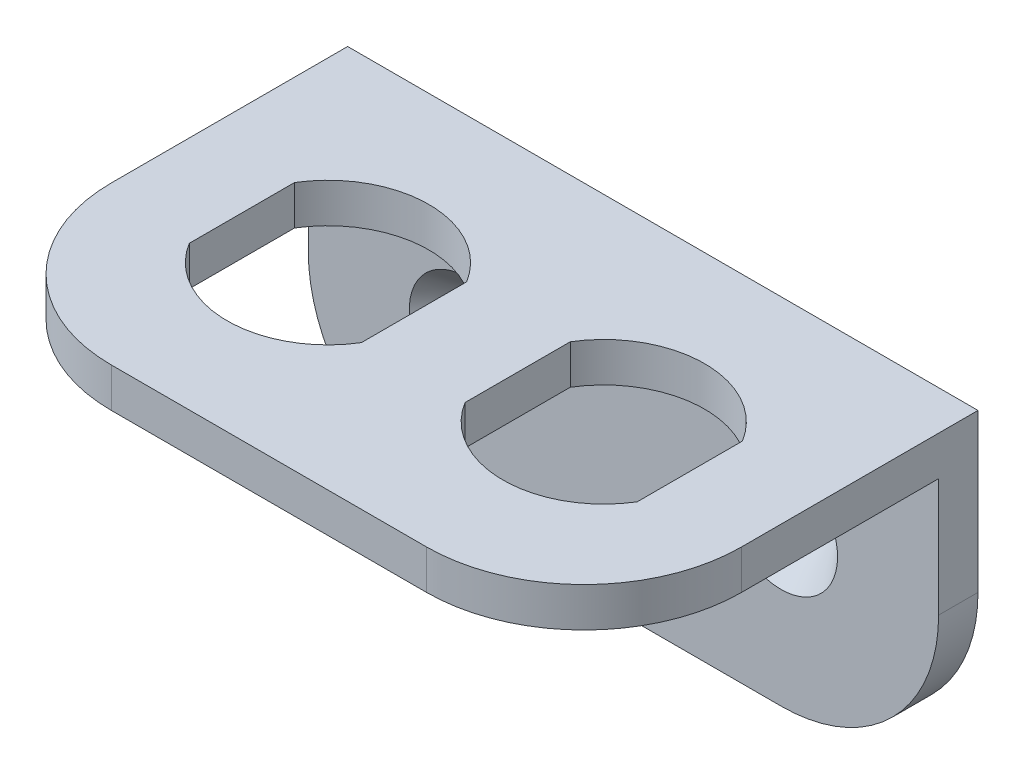
from build123d import *

# Parameters (mm, degrees)
BOSS_EXTRUDE1_DEPTH                           = 50.8
CUT_EXTRUDE1_DEPTH                            = 66.068137364
FILLET1_R                                     = 12.7
CSK_FOR_8_FLAT_HEAD_SOCKET_CAP_SCREW1_A_COUNT = 2
CSK_FOR_8_FLAT_HEAD_SOCKET_CAP_SCREW1_A_PITCH = 25.4


with BuildPart() as part:
    # Sketch1 → Boss-Extrude1 (new body)
    with BuildSketch(Plane(origin=(0, 0, 0), x_dir=(0, 0, -1), z_dir=(1, 0, 0))):
        Polygon((0, 0), (-31.75, 0), (-31.75, -3.175), (-3.175, -3.175), (-3.175, -25.4), (0, -25.4), align=None)
    extrude(amount=BOSS_EXTRUDE1_DEPTH)

    # Sketch2 → Cut-Extrude1 (cut, through all)
    with BuildSketch(Plane(origin=(0, 0, 0), x_dir=(1, 0, 0), z_dir=(0, 1, 0))):
        with BuildLine():
            Line((7.3533, -11.634569083), (7.3533, -20.115430917))
            ThreePointArc((7.3533, -20.115430917), (14.2875, -24.003), (21.2217, -20.115430917))
            Line((21.2217, -20.115430917), (21.2217, -11.634569083))
            ThreePointArc((21.2217, -11.634569083), (14.2875, -7.747), (7.3533, -11.634569083))
        make_face()
        with BuildLine():
            Line((29.5783, -11.634569083), (29.5783, -20.115430917))
            ThreePointArc((29.5783, -20.115430917), (36.5125, -24.003), (43.4467, -20.115430917))
            Line((43.4467, -20.115430917), (43.4467, -11.634569083))
            ThreePointArc((43.4467, -11.634569083), (36.5125, -7.747), (29.5783, -11.634569083))
        make_face()
    extrude(amount=-CUT_EXTRUDE1_DEPTH, mode=Mode.SUBTRACT)

    # Fillet1
    fillet1_edges = [part.edges().sort_by_distance(p)[0] for p in [
        (50.8, -1.5875, 31.75),
        (50.8, -25.4, 1.5875),
        (0, -25.4, 1.5875),
        (0, -1.5875, 31.75),
    ]]
    fillet(fillet1_edges, radius=FILLET1_R)

    # Sketch4 → CSK for #8 Flat Head Socket Cap Screw1 (revolve, cut)
    with BuildSketch(Plane(origin=(12.7, -12.7, 3.175), x_dir=(0, -1, 0), z_dir=(1, 0, 0))):
        Polygon((0, 0), (0, 3.175), (2.2479, 3.175), (2.2479, 2.658961536), (4.5593, 0), align=None)
    csk_for_8_flat_head_socket_cap_screw1 = revolve(axis=Axis((12.7, -12.7, 9.525), (0, 0, -1)), mode=Mode.SUBTRACT)

    # CSK for #8 Flat Head Socket Cap Screw1 a: CSK for #8 Flat Head Socket Cap Screw1 ×2
    with Locations(*[(i * CSK_FOR_8_FLAT_HEAD_SOCKET_CAP_SCREW1_A_PITCH, 0, 0) for i in range(1, CSK_FOR_8_FLAT_HEAD_SOCKET_CAP_SCREW1_A_COUNT)]):
        add(csk_for_8_flat_head_socket_cap_screw1, mode=Mode.SUBTRACT)


solid = part.part
